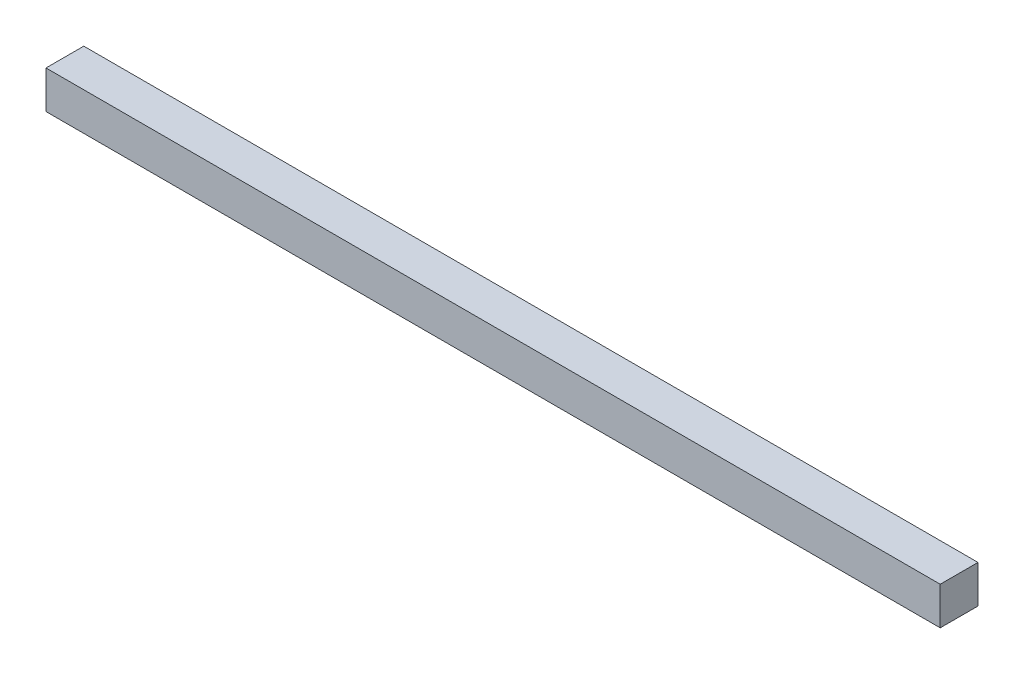
from build123d import *

# Parameters (mm, degrees)
SKETCH1_W           = 710
SKETCH1_H           = 30
BOSS_EXTRUDE1_DEPTH = 30


with BuildPart() as part:
    # Sketch1 → Boss-Extrude1 (new body)
    with BuildSketch(Plane(origin=(0, 0, 0), x_dir=(1, 0, 0), z_dir=(0, 1, 0))):
        with Locations((355, 15)):
            Rectangle(SKETCH1_W, SKETCH1_H)
    extrude(amount=BOSS_EXTRUDE1_DEPTH)


solid = part.part
